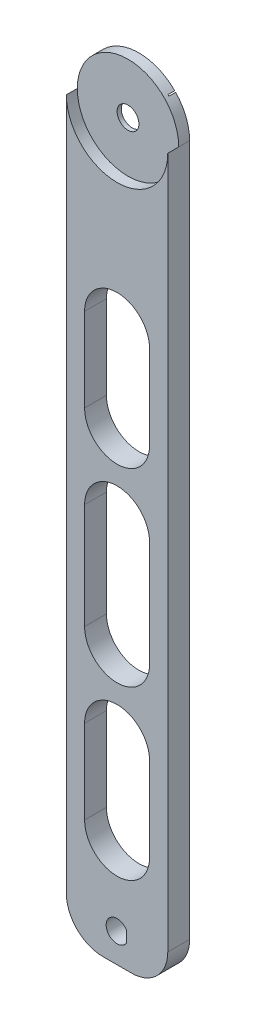
from build123d import *

# Parameters (mm, degrees)
ESQUISSE1_W             = 27.85
ESQUISSE1_H             = 200
BOSS_EXTRU_2_DEPTH      = 6
ENL_V_MAT_EXTRU_1_DEPTH = 6
ENL_V_START             = -3
ESQUISSE4_R             = 13.925
ENL_V_MAT_EXTRU_2_DEPTH = 3
ESQUISSE5_R             = 3
ENL_V_MAT_EXTRU_3_DEPTH = 3
ESQUISSE6_W             = 17.85
ESQUISSE6_H             = 23
ESQUISSE6_H_2           = 29
ENL_V_MAT_EXTRU_4_DEPTH = 10
CONG_1_R                = 10
CONG_2_R                = 10
ESQUISSE9_W             = 20.2
ESQUISSE9_H             = 40.3
ENL_V_MAT_EXTRU_7_DEPTH = 1.85


with BuildPart() as part:
    # Esquisse1 → Boss.-Extru.2 (new body)
    with BuildSketch(Plane.XY):
        with Locations((1.835077519, -78.788662791)):
            Rectangle(ESQUISSE1_W, ESQUISSE1_H)
        with BuildLine():
            Line((-12.089922481, 21.211337209), (15.760077519, 21.211337209))
            ThreePointArc((15.760077519, 21.211337209), (1.835077519, 35.136337209), (-12.089922481, 21.211337209))
        make_face()
    extrude(amount=BOSS_EXTRU_2_DEPTH)

    # Esquisse3 → Enlèv. mat.-Extru.1 (cut)
    with BuildSketch(Plane.XY.offset(6)):
        with BuildLine():
            Line((4.433153731, -172.288662791), (4.433153731, -169.288662791))
            ThreePointArc((4.433153731, -169.288662791), (-1.164922481, -170.788662791), (4.433153731, -172.288662791))
        make_face()
    extrude(amount=-ENL_V_MAT_EXTRU_1_DEPTH, mode=Mode.SUBTRACT)

    # Esquisse4 → Enlèv. mat.-Extru.2 (cut)
    with BuildSketch(Plane.XY.offset(6).offset(ENL_V_START)):
        with Locations((1.835077519, 21.211337209)):
            Circle(ESQUISSE4_R)
    extrude(amount=ENL_V_MAT_EXTRU_2_DEPTH, mode=Mode.SUBTRACT)

    # Esquisse5 → Enlèv. mat.-Extru.3 (cut)
    with BuildSketch(Plane.XY.offset(3)):
        with Locations((1.835077519, 21.211337209)):
            Circle(ESQUISSE5_R)
    extrude(amount=-ENL_V_MAT_EXTRU_3_DEPTH, mode=Mode.SUBTRACT)

    # Esquisse6 → Enlèv. mat.-Extru.4 (cut)
    with BuildSketch(Plane.XY.offset(6)):
        with BuildLine():
            Line((-7.089922481, -27.788662791), (10.760077519, -27.788662791))
            ThreePointArc((10.760077519, -27.788662791), (1.835077519, -18.863662791), (-7.089922481, -27.788662791))
        make_face()
        with Locations((1.835077519, -39.288662791)):
            Rectangle(ESQUISSE6_W, ESQUISSE6_H)
        with BuildLine():
            Line((-7.089922481, -50.788662791), (10.760077519, -50.788662791))
            ThreePointArc((10.760077519, -50.788662791), (1.835077519, -59.713662791), (-7.089922481, -50.788662791))
        make_face()
        with BuildLine():
            ThreePointArc((-7.089922481, -73.788662791), (1.835077519, -64.863662791), (10.760077519, -73.788662791))
            Line((10.760077519, -73.788662791), (-7.089922481, -73.788662791))
        make_face()
        with Locations((1.835077519, -88.288662791)):
            Rectangle(ESQUISSE6_W, ESQUISSE6_H_2)
        with BuildLine():
            Line((-7.089922481, -102.788662791), (10.760077519, -102.788662791))
            ThreePointArc((10.760077519, -102.788662791), (1.835077519, -111.713662791), (-7.089922481, -102.788662791))
        make_face()
        with BuildLine():
            Line((-7.089922481, -125.788662791), (10.760077519, -125.788662791))
            ThreePointArc((10.760077519, -125.788662791), (1.835077519, -116.863662791), (-7.089922481, -125.788662791))
        make_face()
        with Locations((1.835077519, -137.288662791)):
            Rectangle(ESQUISSE6_W, ESQUISSE6_H)
        with BuildLine():
            Line((-7.089922481, -148.788662791), (10.760077519, -148.788662791))
            ThreePointArc((10.760077519, -148.788662791), (1.835077519, -157.713662791), (-7.089922481, -148.788662791))
        make_face()
    extrude(amount=-ENL_V_MAT_EXTRU_4_DEPTH, mode=Mode.SUBTRACT)

    # Congé1
    cong_1_edges = [part.edges().sort_by_distance(p)[0] for p in [
        (-12.089922481, -178.788662791, 3),
    ]]
    fillet(cong_1_edges, radius=CONG_1_R)

    # Congé2
    cong_2_edges = [part.edges().sort_by_distance(p)[0] for p in [
        (15.760077519, -178.788662791, 3),
    ]]
    fillet(cong_2_edges, radius=CONG_2_R)

    # Esquisse9 → Enlèv. mat.-Extru.7 (cut)
    with BuildSketch(Plane(origin=(0, 0, 0), x_dir=(-1, 0, 0), z_dir=(0, 0, -1))):
        with Locations((-1.830077519, 10.911337209)):
            Rectangle(ESQUISSE9_W, ESQUISSE9_H)
    extrude(amount=-ENL_V_MAT_EXTRU_7_DEPTH, mode=Mode.SUBTRACT)


solid = part.part
